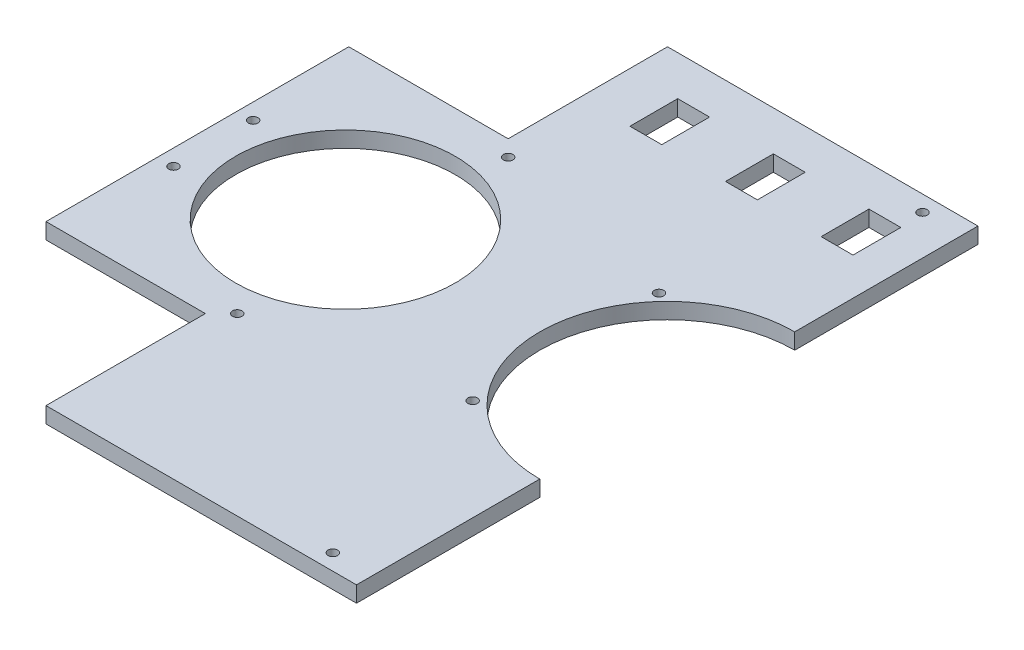
from build123d import *

# Parameters (mm, degrees)
ESQUISSE1_R             = 1.5
ESQUISSE1_R_2           = 34.4618877
BOSS_EXTRU_1_DEPTH      = 5
ENL_V_MAT_EXTRU_1_REACH = 178.814
ESQUISSE2_W             = 10
ESQUISSE2_H             = 15


with BuildPart() as part:
    # Esquisse1 → Boss.-Extru.1 (new body)
    with BuildSketch(Plane(origin=(0, 0, 0), x_dir=(1, 0, 0), z_dir=(0, 1, 0))):
        with BuildLine():
            Line((-97.415, -97.504460786), (0, -97.504460786))
            Line((0, -97.504460786), (0, -40.004460786))
            ThreePointArc((0, -40.004460786), (-40, -0.004460786), (0, 39.995539214))
            Line((0, 39.995539214), (0, 97.495539214))
            Line((0, 97.495539214), (-97.415, 97.495539214))
            Line((-97.415, 97.495539214), (-97.415, 47.495539214))
            Line((-97.415, 47.495539214), (-147.415, 47.495539214))
            Line((-147.415, 47.495539214), (-147.415, -47.504460786))
            Line((-147.415, -47.504460786), (-97.415, -47.504460786))
            Line((-97.415, -47.504460786), (-97.415, -97.504460786))
        make_face()
        with Locations(Location((-142.415, -12.504460786, 0), (0, 0, 270))):
            Circle(ESQUISSE1_R, mode=Mode.SUBTRACT)
        with Locations(Location((-92.415, -42.504460786, 0), (0, 0, 270))):
            Circle(ESQUISSE1_R, mode=Mode.SUBTRACT)
        with Locations(Location((-12.415, -92.504460786, 0), (0, 0, 270))):
            Circle(ESQUISSE1_R, mode=Mode.SUBTRACT)
        with Locations(Location((-31.819805153, -29.234805153, 0), (0, 0, 270))):
            Circle(ESQUISSE1_R, mode=Mode.SUBTRACT)
        with Locations(Location((-142.415, 12.495539214, 0), (0, 0, 270))):
            Circle(ESQUISSE1_R, mode=Mode.SUBTRACT)
        with Locations(Location((-100.973221988, -0.004460786, 0), (0, 0, 270))):
            Circle(ESQUISSE1_R_2, mode=Mode.SUBTRACT)
        with Locations(Location((-92.415, 42.495539214, 0), (0, 0, 270))):
            Circle(ESQUISSE1_R, mode=Mode.SUBTRACT)
        with Locations(Location((-31.819805153, 29.225883581, 0), (0, 0, 270))):
            Circle(ESQUISSE1_R, mode=Mode.SUBTRACT)
        with Locations(Location((-12.415, 92.495539214, 0), (0, 0, 270))):
            Circle(ESQUISSE1_R, mode=Mode.SUBTRACT)
    extrude(amount=BOSS_EXTRU_1_DEPTH)

    # Esquisse2 → Enlèv. mat.-Extru.1 (cut, up to next)
    with BuildSketch(Plane(origin=(0, 5, 0), x_dir=(1, 0, 0), z_dir=(0, 1, 0)), mode=Mode.PRIVATE) as enl_v_mat_extru_1_sk1:
        with Locations((-76.715147883, 77.495539214)):
            Rectangle(ESQUISSE2_W, ESQUISSE2_H)
    enl_v_mat_extru_1_tool1 = extrude(enl_v_mat_extru_1_sk1.sketch, amount=-ENL_V_MAT_EXTRU_1_REACH, mode=Mode.PRIVATE) & part.part
    # Esquisse2 → Enlèv. mat.-Extru.1 (cut, up to next)
    with BuildSketch(Plane(origin=(0, 5, 0), x_dir=(1, 0, 0), z_dir=(0, 1, 0)), mode=Mode.PRIVATE) as enl_v_mat_extru_1_sk2:
        with Locations((-46.715147883, 77.495539214)):
            Rectangle(ESQUISSE2_W, ESQUISSE2_H)
    enl_v_mat_extru_1_tool2 = extrude(enl_v_mat_extru_1_sk2.sketch, amount=-ENL_V_MAT_EXTRU_1_REACH, mode=Mode.PRIVATE) & part.part
    # Esquisse2 → Enlèv. mat.-Extru.1 (cut, up to next)
    with BuildSketch(Plane(origin=(0, 5, 0), x_dir=(1, 0, 0), z_dir=(0, 1, 0)), mode=Mode.PRIVATE) as enl_v_mat_extru_1_sk3:
        with Locations((-16.715147883, 77.495539214)):
            Rectangle(ESQUISSE2_W, ESQUISSE2_H)
    enl_v_mat_extru_1_tool3 = extrude(enl_v_mat_extru_1_sk3.sketch, amount=-ENL_V_MAT_EXTRU_1_REACH, mode=Mode.PRIVATE) & part.part
    add(enl_v_mat_extru_1_tool1.solids().sort_by_distance((-76.715148, 5, -77.495539))[0], mode=Mode.SUBTRACT)
    add(enl_v_mat_extru_1_tool2.solids().sort_by_distance((-46.715148, 5, -77.495539))[0], mode=Mode.SUBTRACT)
    add(enl_v_mat_extru_1_tool3.solids().sort_by_distance((-16.715148, 5, -77.495539))[0], mode=Mode.SUBTRACT)


solid = part.part
